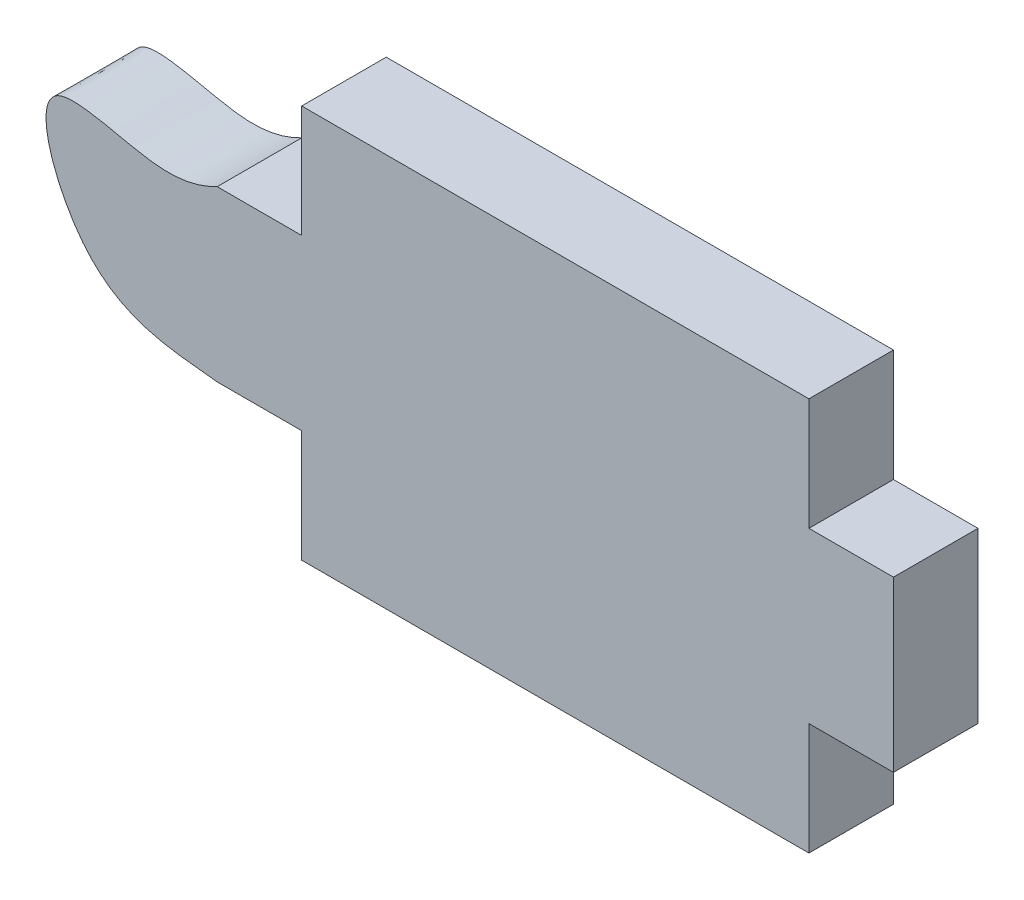
from build123d import *

# Parameters (mm, degrees)
BOSS_EXTRUDE1_DEPTH = 3.175


with BuildPart() as part:
    # Sketch1 → Boss-Extrude1 (new body)
    with BuildSketch(Plane.XY):
        with BuildLine():
            Line((0, 75.526182311), (19.05, 75.526182311))
            Line((19.05, 75.526182311), (19.05, 71.313421555))
            Line((19.05, 71.313421555), (22.225, 71.313421555))
            Line((22.225, 71.313421555), (22.225, 64.963421555))
            Line((22.225, 64.963421555), (19.05, 64.963421555))
            Line((19.05, 64.963421555), (19.05, 60.750660799))
            Line((19.05, 60.750660799), (0, 60.750660799))
            Line((0, 60.750660799), (0, 64.963421555))
            Line((0, 64.963421555), (-3.175, 64.963421555))
            add(Edge.make_bspline(
                [(-3.175, 64.963421555), (-5.108636106, 65.168250885), (-8.266780599, 65.288799196), (-10.432089719, 71.610856743), (-6.445221982, 71.202217844), (-4.881107751, 70.440619428), (-3.175, 71.313421555)],
                knots=[0, 0, 0, 0, 0.353492234, 0.624794573, 0.705320645, 1, 1, 1, 1], degree=3))
            Line((-3.175, 71.313421555), (0, 71.313421555))
            Line((0, 71.313421555), (0, 75.526182311))
        make_face()
    extrude(amount=-BOSS_EXTRUDE1_DEPTH)


solid = part.part
